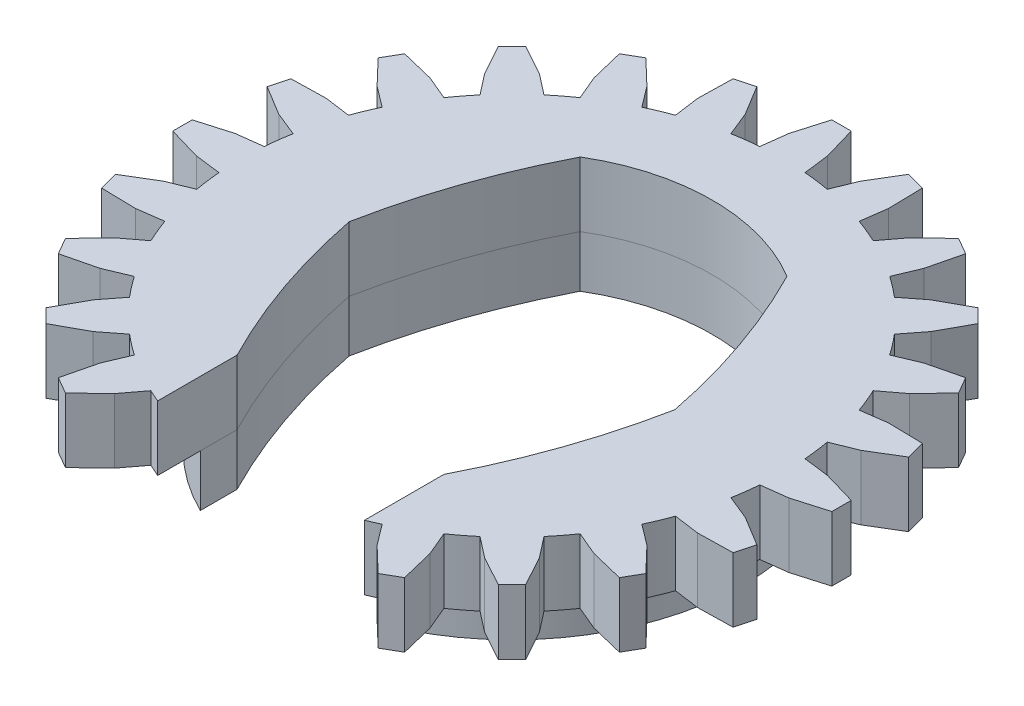
from build123d import *

# Parameters (mm, degrees)
BOSS_EXTRUDE1_DEPTH = 2
BOSS_EXTRUDE2_DEPTH = 2.5
BOSS_EXTRUDE5_DEPTH = 2.5
CIRPATTERN2_COUNT   = 24


with BuildPart() as part:
    # Sketch1 → Boss-Extrude1 (new body)
    with BuildSketch(Plane(origin=(0, 0, 0), x_dir=(1, 0, 0), z_dir=(0, 1, 0))):
        with BuildLine():
            Line((-4, -8.062257748), (-4, -6.637959024))
            ThreePointArc((-4, -6.637959024), (-5.384324957, -3.400171245), (-6.3, 0))
            ThreePointArc((-6.3, 0), (-5.384324957, 3.400171245), (-4, 6.637959024))
            ThreePointArc((-4, 6.637959024), (0, 7.75), (4, 6.637959024))
            ThreePointArc((4, 6.637959024), (5.384324957, 3.400171245), (6.3, 0))
            ThreePointArc((6.3, 0), (5.384324957, -3.400171245), (4, -6.637959024))
            Line((4, -6.637959024), (4, -8.062257748))
            ThreePointArc((4, -8.062257748), (0, 9), (-4, -8.062257748))
        make_face()
    extrude(amount=BOSS_EXTRUDE1_DEPTH)


with BuildPart() as body_2:
    # Sketch2 → Boss-Extrude2 (new body)
    with BuildSketch(Plane(origin=(0, 2, 0), x_dir=(1, 0, 0), z_dir=(0, 1, 0))):
        with BuildLine():
            Line((4, -9.708243919), (4, -8.062257748))
            Line((4, -8.062257748), (4, -6.637959024))
            ThreePointArc((4, -6.637959024), (5.384324957, -3.400171245), (6.3, 0))
            ThreePointArc((6.3, 0), (5.384324957, 3.400171245), (4, 6.637959024))
            ThreePointArc((4, 6.637959024), (0, 7.75), (-4, 6.637959024))
            ThreePointArc((-4, 6.637959024), (-5.384324957, 3.400171245), (-6.3, 0))
            ThreePointArc((-6.3, 0), (-5.384324957, -3.400171245), (-4, -6.637959024))
            Line((-4, -6.637959024), (-4, -8.062257748))
            Line((-4, -8.062257748), (-4, -9.708243919))
            ThreePointArc((-4, -9.708243919), (0, 10.5), (4, -9.708243919))
        make_face()
    extrude(amount=BOSS_EXTRUDE2_DEPTH)

    # Sketch7 → Boss-Extrude5 (add)
    with BuildSketch(Plane(origin=(0, 4.5, 0), x_dir=(1, 0, 0), z_dir=(0, 1, 0))):
        with BuildLine():
            Line((-0.375, 12.75), (0.375, 12.75))
            Line((0.375, 12.75), (0.75, 11.462442433))
            Line((0.75, 11.462442433), (0.875, 10.46347815))
            ThreePointArc((0.875, 10.46347815), (0, 10.5), (-0.875, 10.46347815))
            Line((-0.875, 10.46347815), (-0.75, 11.462442433))
            Line((-0.75, 11.462442433), (-0.375, 12.75))
        make_face()
    boss_extrude5 = extrude(amount=-BOSS_EXTRUDE5_DEPTH)

    # CirPattern2: Boss-Extrude5 ×24 about axis, 3 skipped
    cirpattern2_axis = Axis((0, 0, 0), (0, 1, 0))
    add([boss_extrude5.rotate(cirpattern2_axis, i * 360 / CIRPATTERN2_COUNT) for i in range(1, CIRPATTERN2_COUNT) if i not in (11, 12, 13)])


solid = Compound([part.part, body_2.part])
